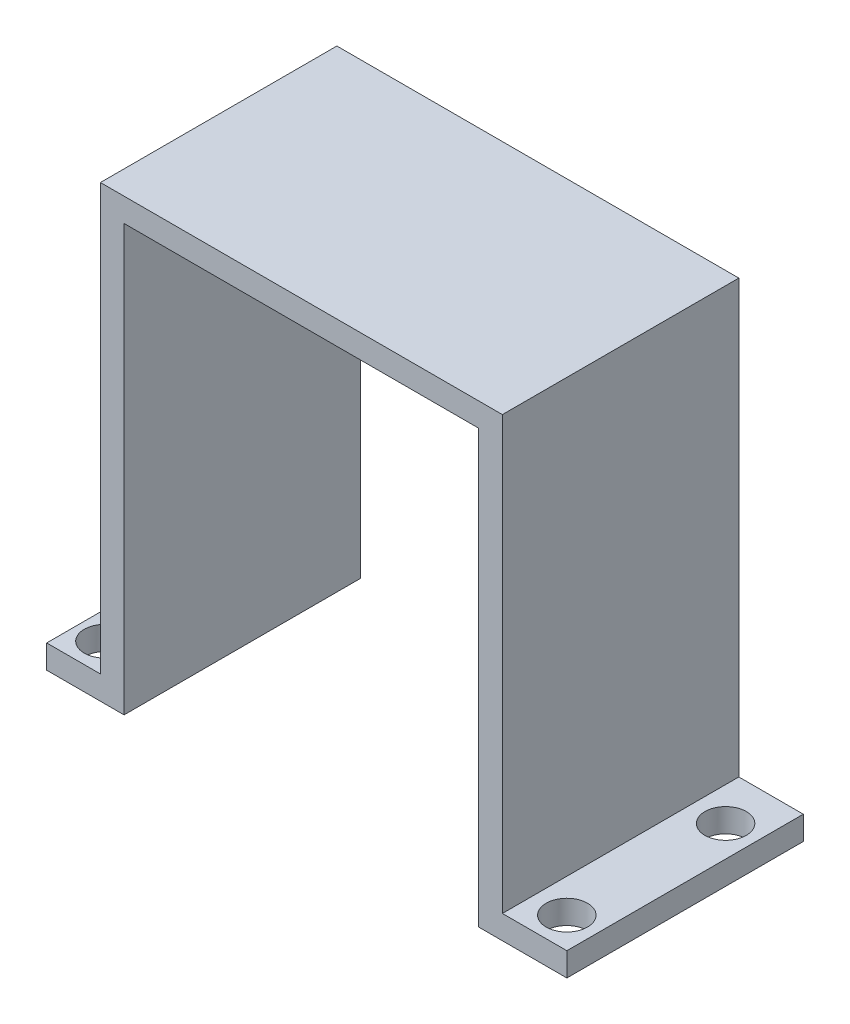
from build123d import *

# Parameters (mm, degrees)
RESSALTO_EXTRUS_O1_DEPTH                      = 20
BROCA_DE_ROSQUEAR_PARA_HELICOIDE_M31_AT_COUNT = 2
BROCA_DE_ROSQUEAR_PARA_HELICOIDE_M31_AT_PITCH = 13.431658115
BROCA_DE_ROSQUEAR_PARA_HELICOIDE_M31_2_COUNT  = 2
BROCA_DE_ROSQUEAR_PARA_HELICOIDE_M31_2_PITCH  = 38.822958194
BROCA_DE_ROSQUEAR_PARA_HELICOIDE_M31_3_COUNT  = 2
BROCA_DE_ROSQUEAR_PARA_HELICOIDE_M31_3_PITCH  = 41.080792624
BROCA_DE_ROSQUEAR_PARA_HELICOIDE_M32_D        = 3.5
BROCA_DE_ROSQUEAR_PARA_HELICOIDE_M32_DEPTH    = 10
BROCA_DE_ROSQUEAR_PARA_HELICOIDE_M32_TIP      = 1.051506083


with BuildPart() as part:
    # Esboço1 → Ressalto-extrusão1 (new body)
    with BuildSketch(Plane.XY):
        Polygon((-29.202088452, -18.454545455), (-29.202088452, -16.454545455), (-24.656633907, -16.454545455), (-24.656633907, 19.545454545), (9.343366093, 19.545454545), (9.343366093, -17), (14.797911548, -17), (14.797911548, -19), (7.343366093, -19), (7.343366093, 17.545454545), (-22.656633907, 17.545454545), (-22.656633907, -16.454545455), (-22.656633907, -18.454545455), align=None)
    extrude(amount=RESSALTO_EXTRUS_O1_DEPTH)

    # Esboço3 → Broca de rosquear para helicoide M31 (revolve, cut)
    with BuildSketch(Plane(origin=(12.189799686, -17, 3.965200957), x_dir=(0, 0, 1), z_dir=(1, 0, 0))):
        Polygon((0, 0), (0, 11.051506083), (1.75, 10), (1.75, 0), align=None)
    broca_de_rosquear_para_helicoide_m31 = revolve(axis=Axis((12.189799686, -10.65, 3.965200957), (0, -1, 0)), mode=Mode.SUBTRACT)

    # Broca de rosquear para helicoide M31 at: Broca de rosquear para helicoide M31 ×2
    with Locations(*[(0, 0, i * BROCA_DE_ROSQUEAR_PARA_HELICOIDE_M31_AT_PITCH) for i in range(1, BROCA_DE_ROSQUEAR_PARA_HELICOIDE_M31_AT_COUNT)]):
        add(broca_de_rosquear_para_helicoide_m31, mode=Mode.SUBTRACT)

    # Broca de rosquear para helicoide M31 2: Broca de rosquear para helicoide M31 ×2
    with Locations(*[(-i * BROCA_DE_ROSQUEAR_PARA_HELICOIDE_M31_2_PITCH, 0, 0) for i in range(1, BROCA_DE_ROSQUEAR_PARA_HELICOIDE_M31_2_COUNT)]):
        add(broca_de_rosquear_para_helicoide_m31, mode=Mode.SUBTRACT)

    # Broca de rosquear para helicoide M31 3: Broca de rosquear para helicoide M31 ×2
    with Locations(*[Vector(-0.9450391707113346, 0, 0.3269571314732758) * (i * BROCA_DE_ROSQUEAR_PARA_HELICOIDE_M31_3_PITCH) for i in range(1, BROCA_DE_ROSQUEAR_PARA_HELICOIDE_M31_3_COUNT)]):
        add(broca_de_rosquear_para_helicoide_m31, mode=Mode.SUBTRACT)

    # Broca de rosquear para helicoide M32
    with Locations(Plane(origin=(0, -16.454545455, 0), x_dir=(1, 0, 0), z_dir=(0, 1, 0))):
        with Locations((-26.864375338, -17.411313342), (-26.864375338, -4.228770119)):
            Hole(BROCA_DE_ROSQUEAR_PARA_HELICOIDE_M32_D / 2, depth=BROCA_DE_ROSQUEAR_PARA_HELICOIDE_M32_DEPTH)
            with Locations((0, 0, -(BROCA_DE_ROSQUEAR_PARA_HELICOIDE_M32_DEPTH + BROCA_DE_ROSQUEAR_PARA_HELICOIDE_M32_TIP / 2))):  # 118° drill point
                Cone(0, BROCA_DE_ROSQUEAR_PARA_HELICOIDE_M32_D / 2, BROCA_DE_ROSQUEAR_PARA_HELICOIDE_M32_TIP, mode=Mode.SUBTRACT)


solid = part.part
